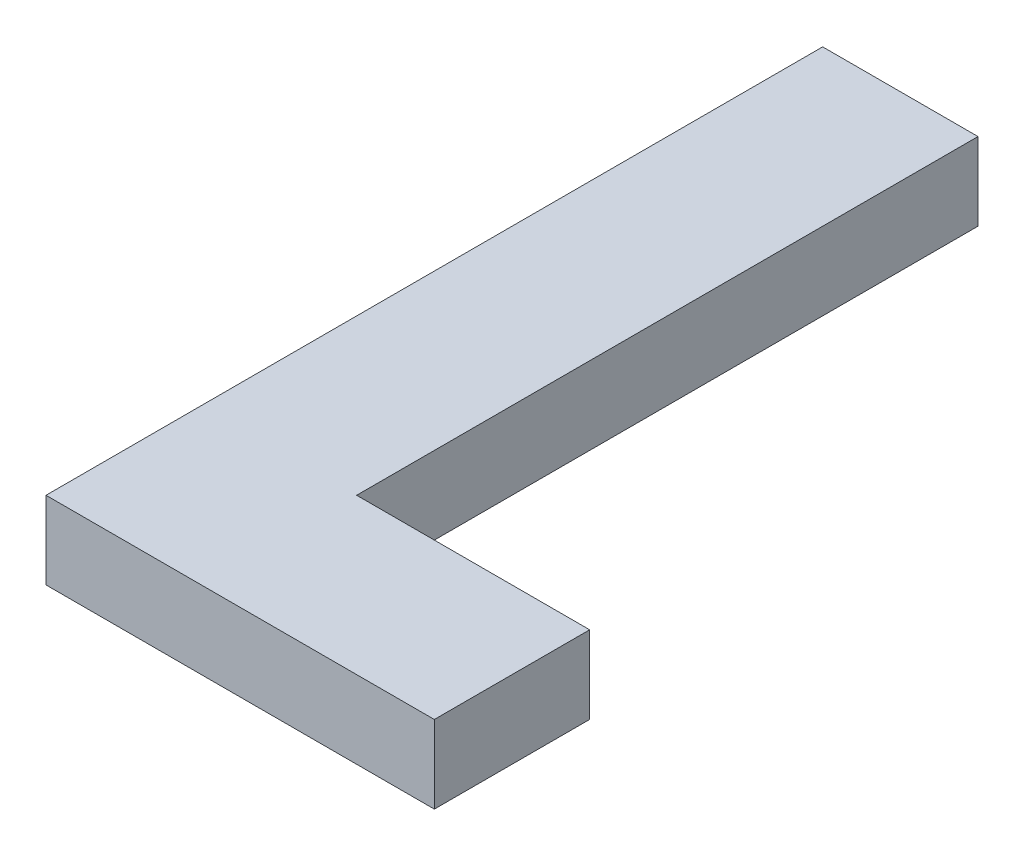
from build123d import *

# Parameters (mm, degrees)
SKETCH1_W           = 20
SKETCH1_H           = 80
BOSS_EXTRUDE1_DEPTH = 10
SKETCH3_W           = 50
SKETCH3_H           = 20
BOSS_EXTRUDE2_DEPTH = 10


with BuildPart() as part:
    # Sketch1 → Boss-Extrude1 (new body)
    with BuildSketch(Plane(origin=(0, 0, 0), x_dir=(1, 0, 0), z_dir=(0, 1, 0))):
        Rectangle(SKETCH1_W, SKETCH1_H)
    extrude(amount=BOSS_EXTRUDE1_DEPTH)

    # Sketch3 → Boss-Extrude2 (add)
    with BuildSketch(Plane(origin=(0, 10, 0), x_dir=(1, 0, 0), z_dir=(0, 1, 0))):
        with Locations((15, -50)):
            Rectangle(SKETCH3_W, SKETCH3_H)
    extrude(amount=-BOSS_EXTRUDE2_DEPTH)


solid = part.part
